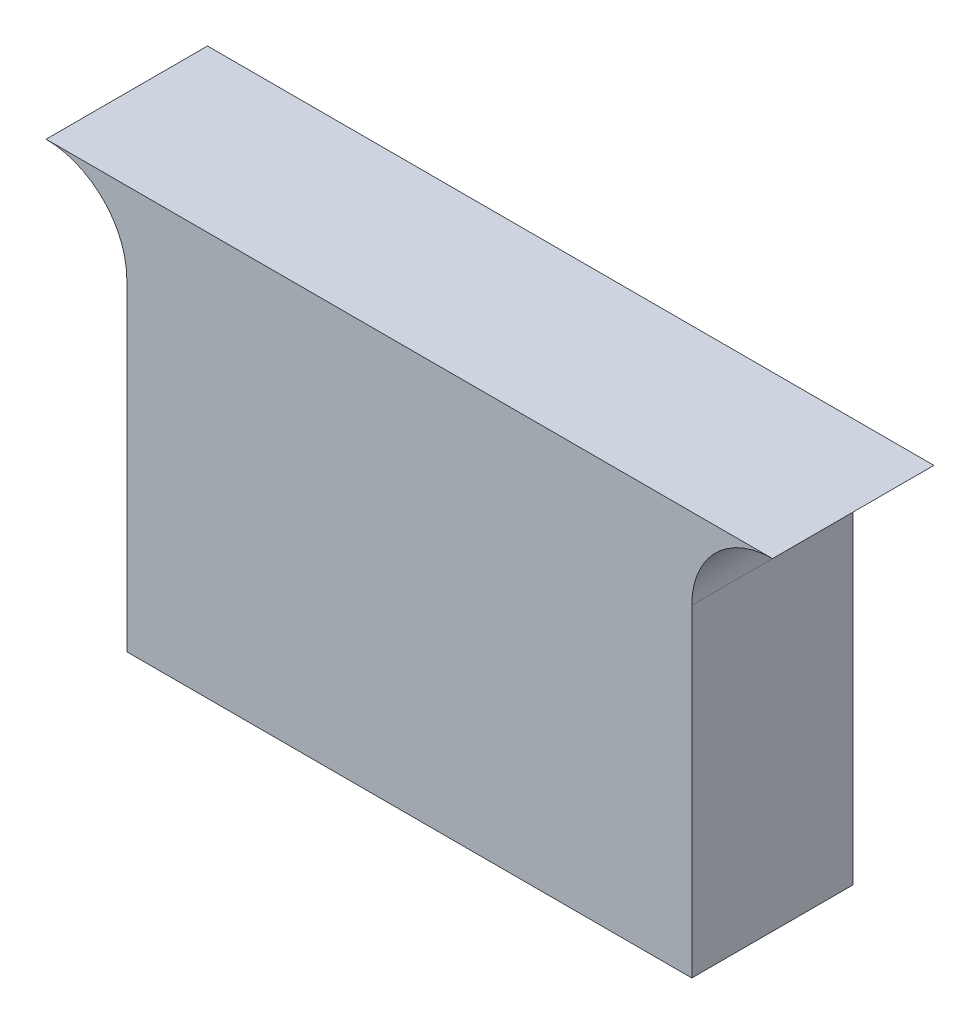
from build123d import *

# Parameters (mm, degrees)
SALIENTE_EXTRUIR2_DEPTH = 4


with BuildPart() as part:
    # Croquis1 → Saliente-Extruir2 (new body)
    with BuildSketch(Plane.XY):
        with BuildLine():
            Line((-16, 0), (-16, -8))
            Line((-16, -8), (-2, -8))
            Line((-2, -8), (-2, 0))
            ThreePointArc((-2, 0), (-1.414213562, 1.414213562), (0, 2))
            Line((0, 2), (-18, 2))
            ThreePointArc((-18, 2), (-16.585786438, 1.414213562), (-16, 0))
        make_face()
    extrude(amount=SALIENTE_EXTRUIR2_DEPTH)


solid = part.part
